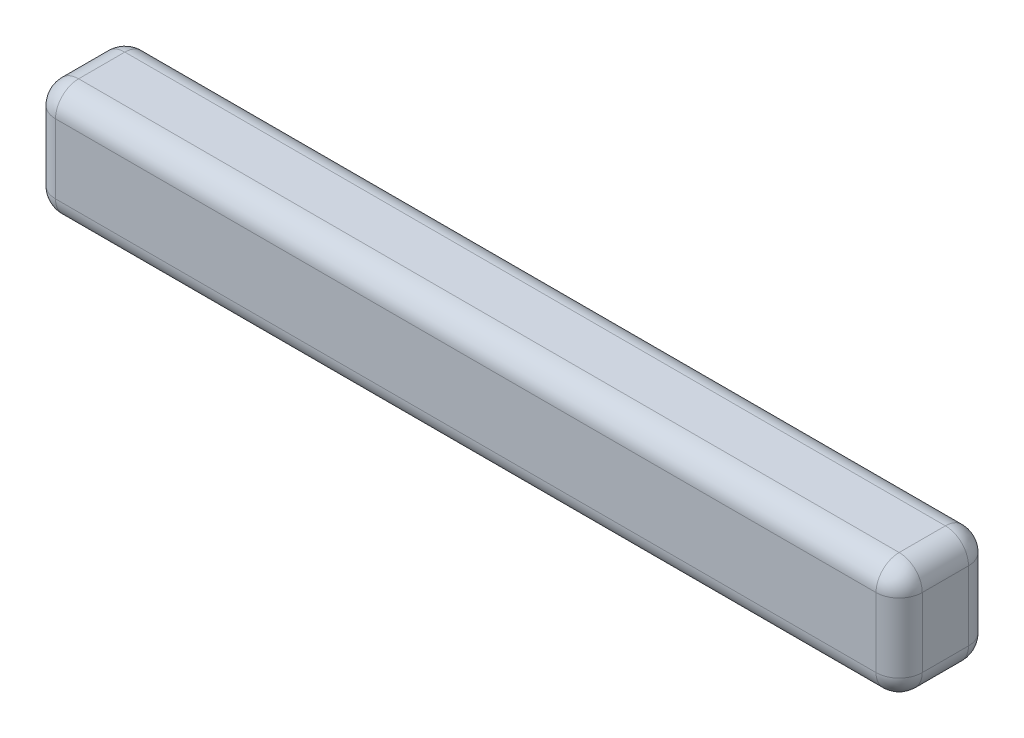
from build123d import *

# Parameters (mm, degrees)
SKETCH1_W           = 37.5
SKETCH1_H           = 4
BOSS_EXTRUDE1_DEPTH = 5
FILLET1_R           = 1


with BuildPart() as part:
    # Sketch1 → Boss-Extrude1 (new body)
    with BuildSketch(Plane(origin=(0, 0, 0), x_dir=(1, 0, 0), z_dir=(0, 1, 0))):
        Rectangle(SKETCH1_W, SKETCH1_H)
    extrude(amount=BOSS_EXTRUDE1_DEPTH)

    # Fillet1
    fillet1_edges = [part.edges().sort_by_distance(p)[0] for p in [
        (-18.75, 5, 0),
        (0, 5, 2),
        (18.75, 5, 0),
        (0, 0, 2),
        (-18.75, 0, 0),
        (0, 0, -2),
        (18.75, 0, 0),
        (0, 5, -2),
        (18.75, 2.5, 2),
        (-18.75, 2.5, 2),
        (-18.75, 2.5, -2),
        (18.75, 2.5, -2),
    ]]
    fillet(fillet1_edges, radius=FILLET1_R)


solid = part.part
